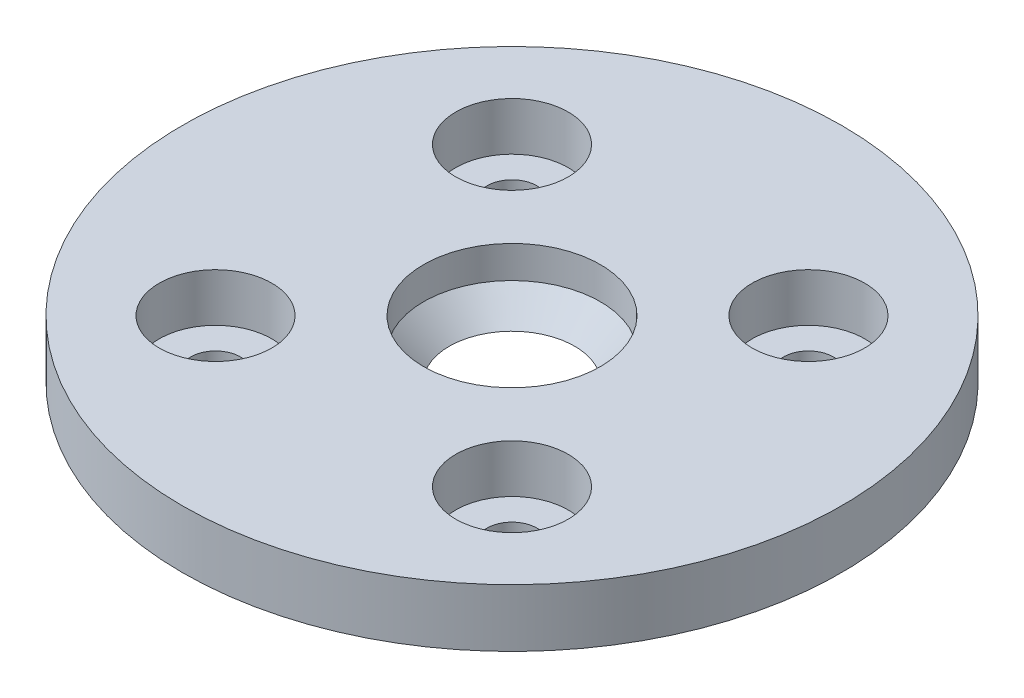
from build123d import *

# Parameters (mm, degrees)
SKETCH1_R                                         = 10.25
BOSS_EXTRUDE1_DEPTH                               = 0.8
CSK_FOR_M2_5_FLAT_HEAD_MACHINE_SCREW1_D           = 2.9
CSK_FOR_M2_5_FLAT_HEAD_MACHINE_SCREW1_DEPTH       = 15
CSK_FOR_M2_5_FLAT_HEAD_MACHINE_SCREW1_CSINK_D     = 5.5
CSK_FOR_M2_5_FLAT_HEAD_MACHINE_SCREW1_CSINK_ANGLE = 90
CSK_FOR_M2_5_FLAT_HEAD_MACHINE_SCREW1_TIP         = 0.871247898
SKETCH2_R                                         = 1.75
CUT_EXTRUDE1_DEPTH                                = 0.5
SKETCH5_R                                         = 0.775
CUT_EXTRUDE2_DEPTH                                = 0.5
BOSS_EXTRUDE2_START                               = 1
SKETCH6_R                                         = 10.25
SKETCH6_R_2                                       = 1.75
SKETCH6_R_3                                       = 2.75
BOSS_EXTRUDE2_DEPTH                               = 1
CUT_EXTRUDE3_DEPTH                                = 1
CUT_EXTRUDE4_DEPTH                                = 1


with BuildPart() as part:
    # Sketch1 → Boss-Extrude1 (new body)
    with BuildSketch(Plane(origin=(0, 0, 0), x_dir=(1, 0, 0), z_dir=(0, 1, 0))):
        with Locations(Location((0, 0, 0), (0, 0, 270))):
            Circle(SKETCH1_R)
    extrude(amount=BOSS_EXTRUDE1_DEPTH)

    # CSK for M2.5 Flat Head Machine Screw1
    with Locations(Plane(origin=(0, 0.8, 0), x_dir=(1, 0, 0), z_dir=(0, 1, 0))):
        with Locations((0, 0)):
            CounterSinkHole(CSK_FOR_M2_5_FLAT_HEAD_MACHINE_SCREW1_D / 2, CSK_FOR_M2_5_FLAT_HEAD_MACHINE_SCREW1_CSINK_D / 2, depth=CSK_FOR_M2_5_FLAT_HEAD_MACHINE_SCREW1_DEPTH, counter_sink_angle=CSK_FOR_M2_5_FLAT_HEAD_MACHINE_SCREW1_CSINK_ANGLE)
            with Locations((0, 0, -(CSK_FOR_M2_5_FLAT_HEAD_MACHINE_SCREW1_DEPTH + CSK_FOR_M2_5_FLAT_HEAD_MACHINE_SCREW1_TIP / 2))):  # 118° drill point
                Cone(0, CSK_FOR_M2_5_FLAT_HEAD_MACHINE_SCREW1_D / 2, CSK_FOR_M2_5_FLAT_HEAD_MACHINE_SCREW1_TIP, mode=Mode.SUBTRACT)

    # Sketch2 → Cut-Extrude1 (cut)
    with BuildSketch(Plane(origin=(0, 0.8, 0), x_dir=(1, 0, 0), z_dir=(0, 1, 0))):
        with Locations(Location((-4.610336213, -4.610336213, 0), (0, 0, 270))):
            Circle(SKETCH2_R)
        with Locations(Location((4.610336213, 4.610336213, 0), (0, 0, 270))):
            Circle(SKETCH2_R)
        with Locations(Location((4.610336213, -4.610336213, 0), (0, 0, 270))):
            Circle(SKETCH2_R)
        with Locations(Location((-4.610336213, 4.610336213, 0), (0, 0, 270))):
            Circle(SKETCH2_R)
    extrude(amount=-CUT_EXTRUDE1_DEPTH, mode=Mode.SUBTRACT)

    # Sketch5 → Cut-Extrude2 (cut)
    with BuildSketch(Plane(origin=(0, 0.3, 0), x_dir=(1, 0, 0), z_dir=(0, 1, 0))):
        with Locations(Location((-4.610336213, -4.610336213, 0), (0, 0, 270))):
            Circle(SKETCH5_R)
        with Locations(Location((4.610336213, 4.610336213, 0), (0, 0, 270))):
            Circle(SKETCH5_R)
        with Locations(Location((4.610336213, -4.610336213, 0), (0, 0, 270))):
            Circle(SKETCH5_R)
        with Locations(Location((-4.610336213, 4.610336213, 0), (0, 0, 270))):
            Circle(SKETCH5_R)
    extrude(amount=-CUT_EXTRUDE2_DEPTH, mode=Mode.SUBTRACT)

    # Sketch6 → Boss-Extrude2 (add)
    with BuildSketch(Plane(origin=(0, 0.8, 0), x_dir=(1, 0, 0), z_dir=(0, 1, 0)).offset(BOSS_EXTRUDE2_START)):
        with Locations(Location((0, 0, 0), (0, 0, 270))):
            Circle(SKETCH6_R)
        with Locations(Location((4.610336213, 4.610336213, 0), (0, 0, 270))):
            Circle(SKETCH6_R_2, mode=Mode.SUBTRACT)
        with Locations(Location((0, 0, 0), (0, 0, 270))):
            Circle(SKETCH6_R_3, mode=Mode.SUBTRACT)
        with Locations(Location((-4.610336213, -4.610336213, 0), (0, 0, 270))):
            Circle(SKETCH6_R_2, mode=Mode.SUBTRACT)
        with Locations(Location((4.610336213, -4.610336213, 0), (0, 0, 270))):
            Circle(SKETCH6_R_2, mode=Mode.SUBTRACT)
        with Locations(Location((-4.610336213, 4.610336213, 0), (0, 0, 270))):
            Circle(SKETCH6_R_2, mode=Mode.SUBTRACT)
    extrude(amount=-BOSS_EXTRUDE2_DEPTH)

    # Sketch12 → Cut-Extrude3 (cut)
    with BuildSketch(Plane.XZ):
        with BuildLine():
            Line((-3.21438925, 7.852976026), (-2.257680669, 5.543277195))
            ThreePointArc((-2.257680669, 5.543277195), (0.038419926, 6), (2.33452052, 5.543277195))
            Line((2.33452052, 5.543277195), (3.291229101, 7.852976026))
            ThreePointArc((3.291229101, 7.852976026), (0.038419926, 8.5), (-3.21438925, 7.852976026))
        make_face()
        with BuildLine():
            Line((-5.50485727, 2.296100594), (-7.814556101, 3.252809175))
            ThreePointArc((-7.814556101, 3.252809175), (-8.461580074, 0), (-7.814556101, -3.252809175))
            Line((-7.814556101, -3.252809175), (-5.50485727, -2.296100594))
            ThreePointArc((-5.50485727, -2.296100594), (-5.961580074, 0), (-5.50485727, 2.296100594))
        make_face()
        with BuildLine():
            Line((-2.257680669, -5.543277195), (-3.21438925, -7.852976026))
            ThreePointArc((-3.21438925, -7.852976026), (0.038419926, -8.5), (3.291229101, -7.852976026))
            Line((3.291229101, -7.852976026), (2.33452052, -5.543277195))
            ThreePointArc((2.33452052, -5.543277195), (0.038419926, -6), (-2.257680669, -5.543277195))
        make_face()
        with BuildLine():
            Line((7.891395952, 3.252809175), (5.581697121, 2.296100594))
            ThreePointArc((5.581697121, 2.296100594), (6.038419926, 0), (5.581697121, -2.296100594))
            Line((5.581697121, -2.296100594), (7.891395952, -3.252809175))
            ThreePointArc((7.891395952, -3.252809175), (8.538419926, 0), (7.891395952, 3.252809175))
        make_face()
    extrude(amount=-CUT_EXTRUDE3_DEPTH, mode=Mode.SUBTRACT)

    # Sketch13 → Cut-Extrude4 (cut)
    with BuildSketch(Plane(origin=(0, 0, 0), x_dir=(-1, 0, 0), z_dir=(0, -1, 0))):
        with BuildLine():
            Line((2.32440044, 4.984692829), (3.803564356, 8.156770083))
            ThreePointArc((3.803564356, 8.156770083), (0, 9), (-3.803564356, 8.156770083))
            Line((-3.803564356, 8.156770083), (-2.32440044, 4.984692829))
            ThreePointArc((-2.32440044, 4.984692829), (0, 5.5), (2.32440044, 4.984692829))
        make_face()
        with BuildLine():
            Line((4.984692829, 2.32440044), (8.156770083, 3.803564356))
            ThreePointArc((8.156770083, 3.803564356), (9, 0), (8.156770083, -3.803564356))
            Line((8.156770083, -3.803564356), (4.984692829, -2.32440044))
            ThreePointArc((4.984692829, -2.32440044), (5.5, 0), (4.984692829, 2.32440044))
        make_face()
        with BuildLine():
            Line((2.32440044, -4.984692829), (3.803564356, -8.156770083))
            ThreePointArc((3.803564356, -8.156770083), (0, -9), (-3.803564356, -8.156770083))
            Line((-3.803564356, -8.156770083), (-2.32440044, -4.984692829))
            ThreePointArc((-2.32440044, -4.984692829), (0, -5.5), (2.32440044, -4.984692829))
        make_face()
        with BuildLine():
            Line((-4.984692829, -2.32440044), (-8.156770083, -3.803564356))
            ThreePointArc((-8.156770083, -3.803564356), (-9, 0), (-8.156770083, 3.803564356))
            Line((-8.156770083, 3.803564356), (-4.984692829, 2.32440044))
            ThreePointArc((-4.984692829, 2.32440044), (-5.5, 0), (-4.984692829, -2.32440044))
        make_face()
    extrude(amount=-CUT_EXTRUDE4_DEPTH, mode=Mode.SUBTRACT)


solid = part.part
